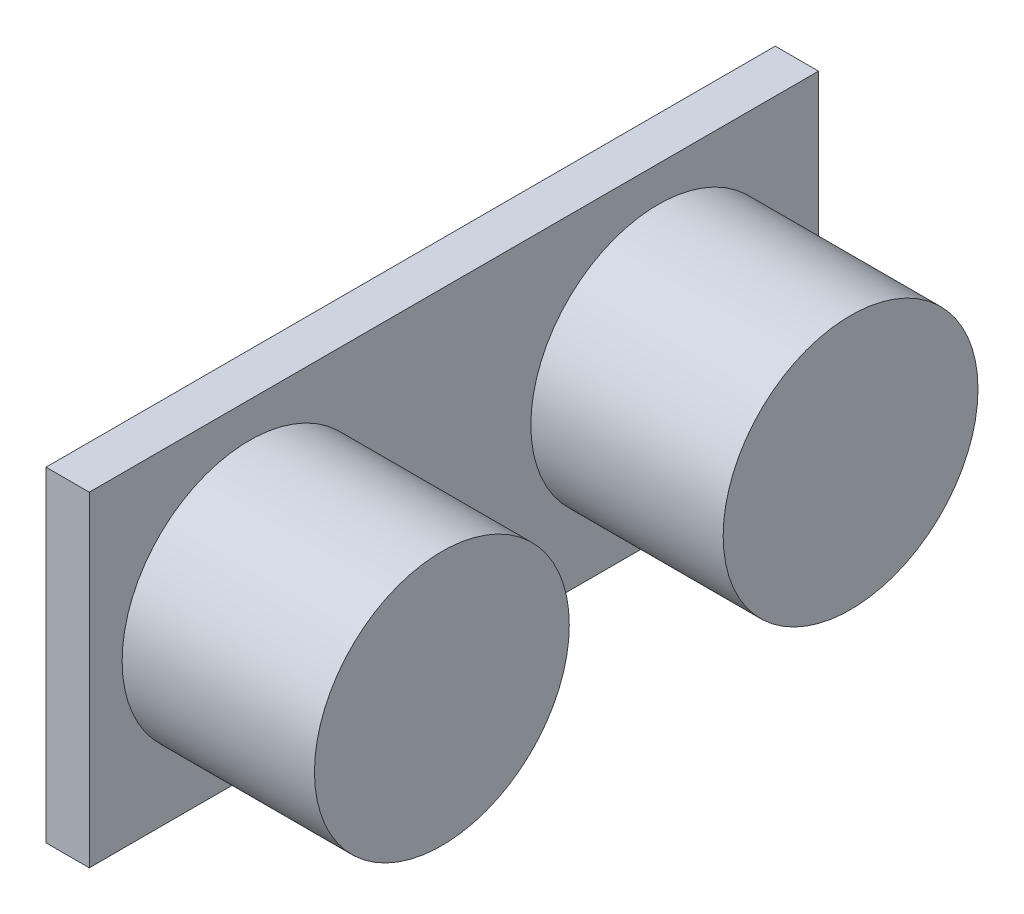
from build123d import *

# Parameters (mm, degrees)
SKETCH1_W           = 45.5
SKETCH1_H           = 20.3
BOSS_EXTRUDE1_DEPTH = 2.7
SKETCH2_R           = 7.95
BOSS_EXTRUDE2_DEPTH = 12


with BuildPart() as part:
    # Sketch1 → Boss-Extrude1 (new body)
    with BuildSketch(Plane(origin=(0, 0, 0), x_dir=(0, 0, -1), z_dir=(1, 0, 0))):
        with Locations((22.75, 10.15)):
            Rectangle(SKETCH1_W, SKETCH1_H)
    extrude(amount=BOSS_EXTRUDE1_DEPTH)

    # Sketch2 → Boss-Extrude2 (add)
    with BuildSketch(Plane(origin=(2.7, 0, 0), x_dir=(0, 0, -1), z_dir=(1, 0, 0))):
        with Locations(Location((10, 10.15, 0), (0, 0, 180))):
            Circle(SKETCH2_R)
        with Locations(Location((35.5, 10.15, 0), (0, 0, 180))):
            Circle(SKETCH2_R)
    extrude(amount=BOSS_EXTRUDE2_DEPTH)


solid = part.part
